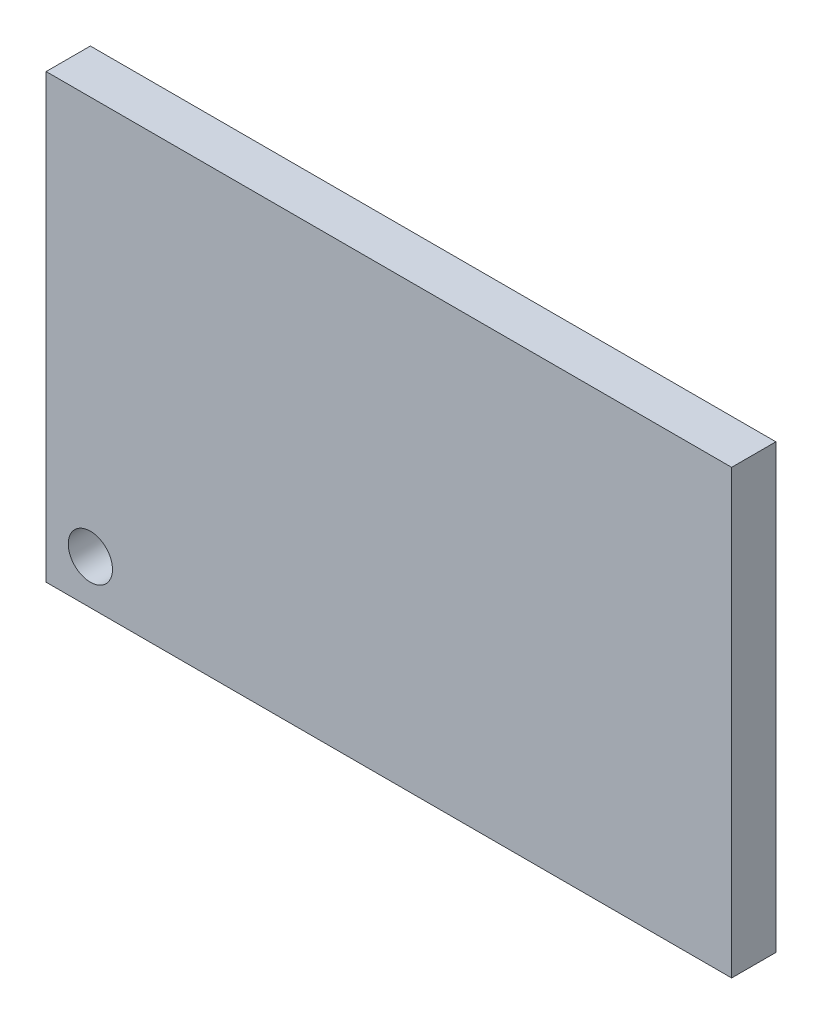
from build123d import *

# Parameters (mm, degrees)
SKETCH1_W           = 155
SKETCH1_H           = 100
BOSS_EXTRUDE1_DEPTH = 10
SKETCH2_R           = 5
CUT_EXTRUDE1_DEPTH  = 93.769876576


with BuildPart() as part:
    # Sketch1 → Boss-Extrude1 (new body)
    with BuildSketch(Plane.XY):
        Rectangle(SKETCH1_W, SKETCH1_H)
    extrude(amount=BOSS_EXTRUDE1_DEPTH)

    # Sketch2 → Cut-Extrude1 (cut, through all)
    with BuildSketch(Plane.XY.offset(10)):
        with Locations((-67.5, -40)):
            Circle(SKETCH2_R)
    extrude(amount=-CUT_EXTRUDE1_DEPTH, mode=Mode.SUBTRACT)


solid = part.part
